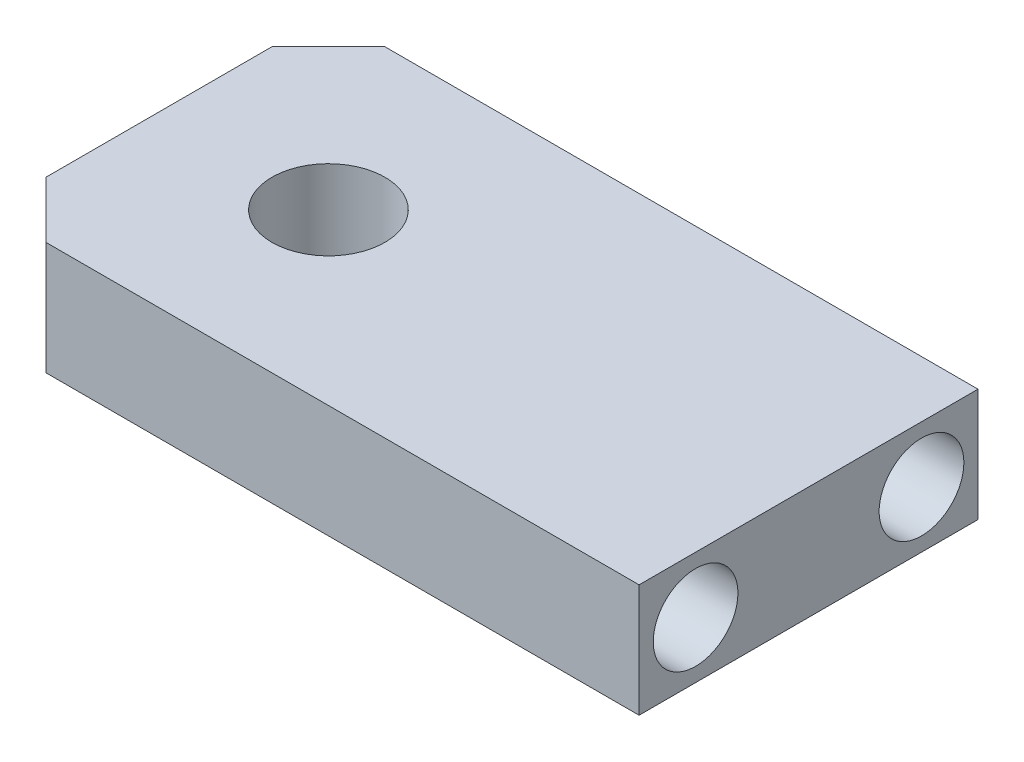
from build123d import *

# Parameters (mm, degrees)
SKETCH1_W           = 23
SKETCH1_H           = 12
BOSS_EXTRUDE1_DEPTH = 4
SKETCH2_R           = 1.5
CUT_EXTRUDE1_DEPTH  = 10
SKETCH3_R           = 2
CUT_EXTRUDE2_DEPTH  = 14.57387196
CHAMFER1_SIZE       = 2


with BuildPart() as part:
    # Sketch1 → Boss-Extrude1 (new body)
    with BuildSketch(Plane(origin=(0, 0, 0), x_dir=(1, 0, 0), z_dir=(0, 1, 0))):
        Rectangle(SKETCH1_W, SKETCH1_H)
    extrude(amount=BOSS_EXTRUDE1_DEPTH)

    # Sketch2 → Cut-Extrude1 (cut)
    with BuildSketch(Plane(origin=(11.5, 0, 0), x_dir=(0, 0, -1), z_dir=(1, 0, 0))):
        with Locations((-4, 2)):
            Circle(SKETCH2_R)
        with Locations((4, 2)):
            Circle(SKETCH2_R)
    extrude(amount=-CUT_EXTRUDE1_DEPTH, mode=Mode.SUBTRACT)

    # Sketch3 → Cut-Extrude2 (cut, through all)
    with BuildSketch(Plane(origin=(0, 4, 0), x_dir=(1, 0, 0), z_dir=(0, 1, 0))):
        with Locations(Location((-5.5, 0, 0), (0, 0, 270))):
            Circle(SKETCH3_R)
    extrude(amount=-CUT_EXTRUDE2_DEPTH, mode=Mode.SUBTRACT)

    # Chamfer1
    chamfer1_edges = [part.edges().sort_by_distance(p)[0] for p in [
        (-11.5, 2, 6),
        (-11.5, 2, -6),
    ]]
    chamfer(chamfer1_edges, length=CHAMFER1_SIZE)


solid = part.part
